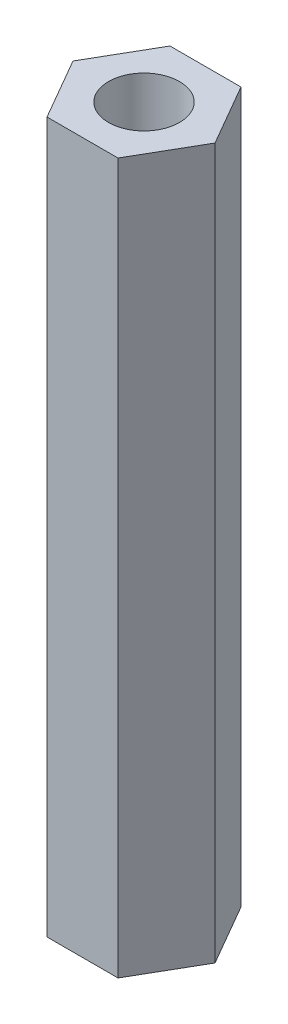
from build123d import *

# Parameters (mm, degrees)
SKETCH1_R           = 1.25
BOSS_EXTRUDE1_DEPTH = 25


with BuildPart() as part:
    # Sketch1 → Boss-Extrude1 (new body)
    with BuildSketch(Plane(origin=(0, 0, 0), x_dir=(1, 0, 0), z_dir=(0, 1, 0))):
        Polygon((1.25, 2.165063509), (-1.25, 2.165063509), (-2.5, 0), (-1.25, -2.165063509), (1.25, -2.165063509), (2.5, 0), align=None)
        with Locations(Location((0, 0, 0), (0, 0, 270))):
            Circle(SKETCH1_R, mode=Mode.SUBTRACT)
    extrude(amount=BOSS_EXTRUDE1_DEPTH)


solid = part.part
